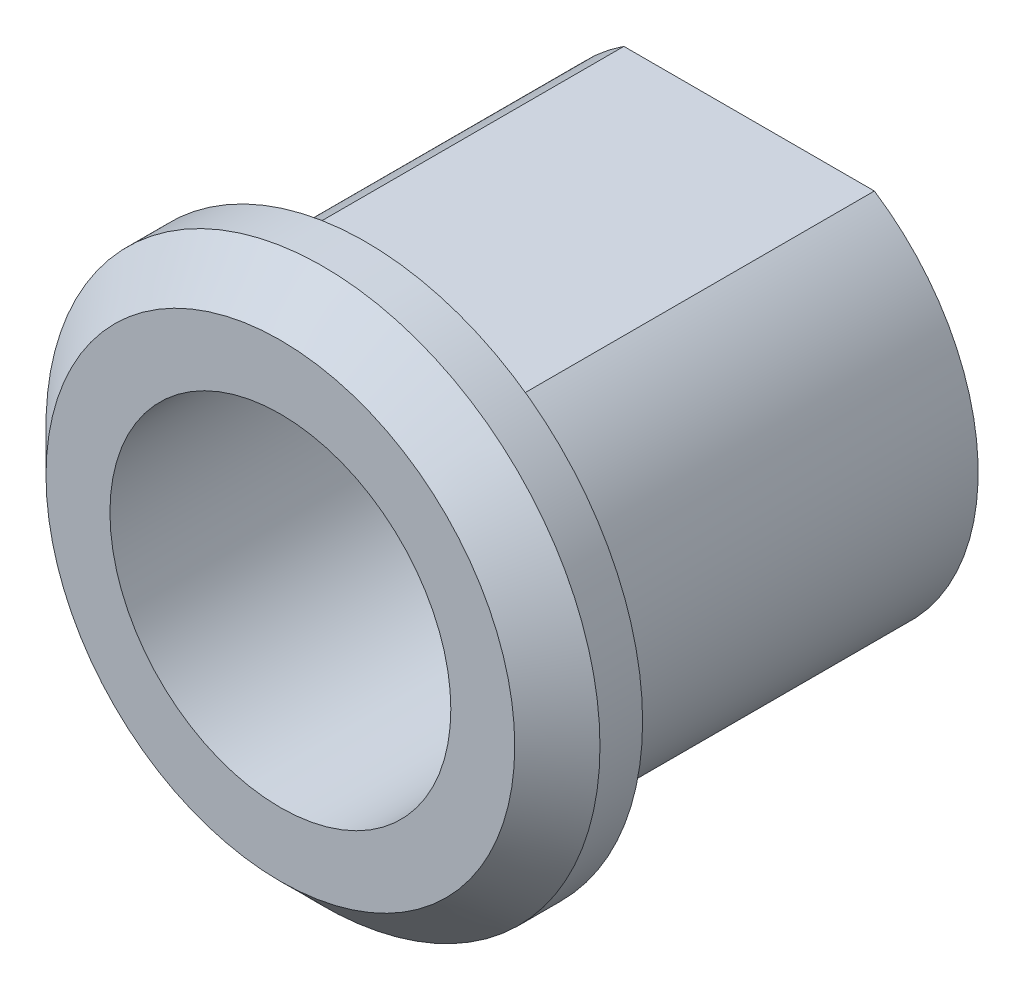
from build123d import *

# Parameters (mm, degrees)
SKETCH1_R           = 13
SKETCH1_R_2         = 8
BOSS_EXTRUDE1_DEPTH = 4
BOSS_EXTRUDE2_DEPTH = 18
CUT_EXTRUDE1_START  = -18
SKETCH3_R           = 8
CUT_EXTRUDE1_DEPTH  = 18
CHAMFER1_SIZE       = 2


with BuildPart() as part:
    # Sketch1 → Boss-Extrude1 (new body)
    with BuildSketch(Plane.XY):
        Circle(SKETCH1_R)
        Circle(SKETCH1_R_2, mode=Mode.SUBTRACT)
    extrude(amount=BOSS_EXTRUDE1_DEPTH)

    # Sketch2 → Boss-Extrude2 (add)
    with BuildSketch(Plane(origin=(0, 0, 0), x_dir=(-1, 0, 0), z_dir=(0, 0, -1))):
        with BuildLine():
            Line((-5.878988008, 9), (5.878988008, 9))
            ThreePointArc((5.878988008, 9), (10.75, 0), (5.878988008, -9))
            Line((5.878988008, -9), (-5.878988008, -9))
            ThreePointArc((-5.878988008, -9), (-10.75, 0), (-5.878988008, 9))
        make_face()
    extrude(amount=BOSS_EXTRUDE2_DEPTH)

    # Sketch3 → Cut-Extrude1 (cut)
    with BuildSketch(Plane.XY.offset(CUT_EXTRUDE1_START)):
        Circle(SKETCH3_R)
    extrude(amount=CUT_EXTRUDE1_DEPTH, mode=Mode.SUBTRACT)

    # Chamfer1
    chamfer1_edges = [part.edges().sort_by_distance(p)[0] for p in [
        (-13, 0, 4),
    ]]
    chamfer(chamfer1_edges, length=CHAMFER1_SIZE)


solid = part.part
